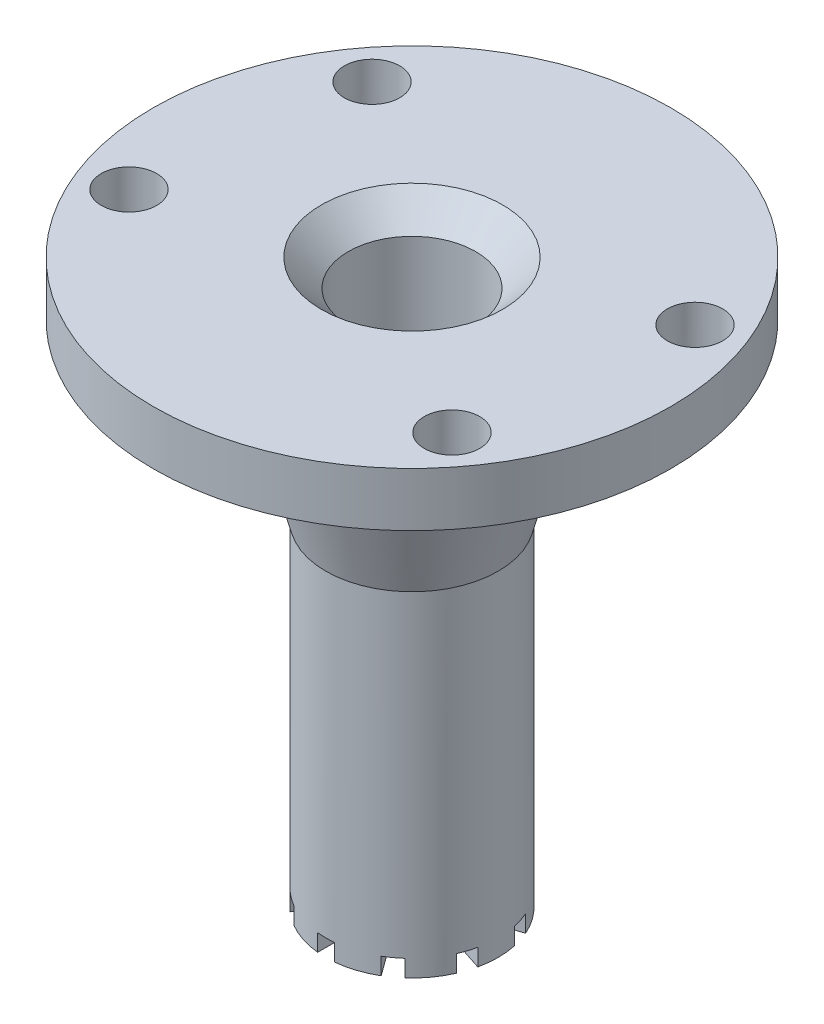
from build123d import *

# Parameters (mm, degrees)
SKETCH5_R                   = 7.5
CUT_EXTRUDE1_DEPTH          = 90
SKETCH6_R                   = 3.5
CUT_EXTRUDE2_DEPTH          = 20
CIRPATTERN1_COUNT           = 6
SKETCH11_R                  = 3.18
CUT_EXTRUDE4_DEPTH          = 101.105860558
SKETCH23_R                  = 30.48
CUT_EXTRUDE6_DEPTH          = 80.122584091
F_1_4_CLEARANCE_HOLE1_D     = 6.5278
F_1_4_CLEARANCE_HOLE1_DEPTH = 15.4203
F_1_4_CLEARANCE_HOLE1_TIP   = 1.961148974
CHAMFER1_SIZE               = 3.175
SKETCH26_OUTSIDE_W          = 84.718
SKETCH26_OUTSIDE_H          = 84.718
SKETCH26_OUTSIDE_R          = 15
FOR_TURNING_EASE_DEPTH      = 74.878689756
SKETCH29_W                  = 2
SKETCH29_H                  = 2
CUT_EXTRUDE7_DEPTH          = 74.878689756
CIRPATTERN4_COUNT           = 5


with BuildPart() as part:
    # Sketch1 → Revolve1 (revolve)
    with BuildSketch(Plane(origin=(0, 0, 0), x_dir=(0, 0, -1), z_dir=(1, 0, 0))):
        Polygon((0, 30.35), (12.7, 30.35), (12.7, 6.35), (30.48, 6.35), (30.48, 0), (15.68, 0), (10.16, -20.600920458), (10.16, -60), (0, -60), align=None)
    revolve(axis=Axis((0, 0, 0), (0, 1, 0)))

    # Sketch5 → Cut-Extrude1 (cut)
    with BuildSketch(Plane.XZ.offset(60)):
        Circle(SKETCH5_R)
    extrude(amount=-CUT_EXTRUDE1_DEPTH, mode=Mode.SUBTRACT)

    # Sketch6 → Cut-Extrude2 (cut, symmetric)
    with BuildSketch(Plane.XY):
        with Locations((0, 16.659966967)):
            Circle(SKETCH6_R)
    cut_extrude2 = extrude(amount=CUT_EXTRUDE2_DEPTH, both=True, mode=Mode.SUBTRACT)

    # CirPattern1: Cut-Extrude2 ×6 about axis
    cirpattern1_axis = Axis((0, 30.35, 0), (0, -1, 0))
    for i in range(1, CIRPATTERN1_COUNT):
        add(cut_extrude2.rotate(cirpattern1_axis, i * 360 / CIRPATTERN1_COUNT), mode=Mode.SUBTRACT)

    # Sketch11 → Cut-Extrude4 (cut, through all)
    with BuildSketch(Plane(origin=(0, 30.35, 0), x_dir=(1, 0, 0), z_dir=(0, 1, 0))):
        Circle(SKETCH11_R)
    extrude(amount=-CUT_EXTRUDE4_DEPTH, mode=Mode.SUBTRACT)

    # Sketch23 → Cut-Extrude6 (cut, through all)
    with BuildSketch(Plane(origin=(0, 6.35, 0), x_dir=(1, 0, 0), z_dir=(0, 1, 0))):
        Circle(SKETCH23_R)
    extrude(amount=CUT_EXTRUDE6_DEPTH, mode=Mode.SUBTRACT)

    # 1/4 Clearance Hole1
    with Locations(Plane(origin=(0, 6.35, 0), x_dir=(1, 0, 0), z_dir=(0, 1, 0))):
        with Locations((-20.240427094, 15.531025958), (23.570476573, 9.763211068), (20.240427094, -15.531025958), (-23.570476573, -9.763211068)):
            Hole(F_1_4_CLEARANCE_HOLE1_D / 2, depth=F_1_4_CLEARANCE_HOLE1_DEPTH)
            with Locations((0, 0, -(F_1_4_CLEARANCE_HOLE1_DEPTH + F_1_4_CLEARANCE_HOLE1_TIP / 2))):  # 118° drill point
                Cone(0, F_1_4_CLEARANCE_HOLE1_D / 2, F_1_4_CLEARANCE_HOLE1_TIP, mode=Mode.SUBTRACT)

    # Chamfer1
    chamfer1_edges = [part.edges().sort_by_distance(p)[0] for p in [
        (-7.5, 6.35, 0),
    ]]
    chamfer(chamfer1_edges, length=CHAMFER1_SIZE)

    # Sketch26 outside → for-turning-ease (cut, through all)
    with BuildSketch(Plane.XZ):
        Rectangle(SKETCH26_OUTSIDE_W, SKETCH26_OUTSIDE_H)
        Circle(SKETCH26_OUTSIDE_R, mode=Mode.SUBTRACT)
    extrude(amount=FOR_TURNING_EASE_DEPTH, mode=Mode.SUBTRACT)

    # Sketch29 → Cut-Extrude7 (cut, symmetric)
    with BuildSketch(Plane.XY):
        with Locations((0, -59)):
            Rectangle(SKETCH29_W, SKETCH29_H)
    cut_extrude7 = extrude(amount=CUT_EXTRUDE7_DEPTH, both=True, mode=Mode.SUBTRACT)

    # CirPattern4: Cut-Extrude7 ×5 about axis
    cirpattern4_axis = Axis((0, -60, 0), (0, -1, 0))
    for i in range(1, CIRPATTERN4_COUNT):
        add(cut_extrude7.rotate(cirpattern4_axis, i * 360 / CIRPATTERN4_COUNT), mode=Mode.SUBTRACT)


solid = part.part
